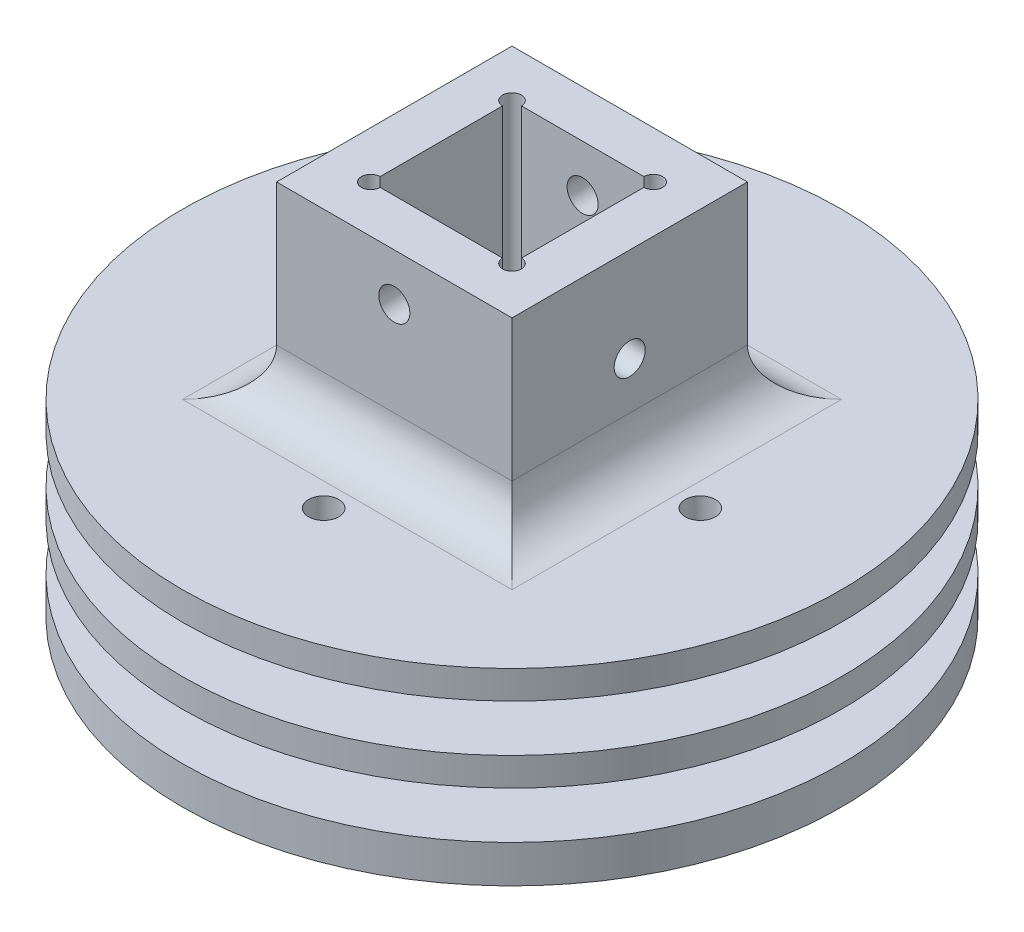
from build123d import *

# Parameters (mm, degrees)
SKETCH_1_R          = 35
EXTRUDE_1_DEPTH     = 4
SKETCH_2_R          = 25
EXTRUDE_2_DEPTH     = 5
SKETCH_3_R          = 35
EXTRUDE_3_DEPTH     = 3
SKETCH_4_R          = 25
EXTRUDE_4_DEPTH     = 5
SKETCH_5_R          = 35
EXTRUDE_5_DEPTH     = 3
CUT_EXTRUDE_1_REACH = 55.385
SKETCH_6_R          = 1.6
SKETCH_7_R          = 10
CUT_EXTRUDE_2_DEPTH = 5
SKETCH_10_W         = 25
SKETCH_10_H         = 25
SKETCH_10_W_2       = 15
SKETCH_10_H_2       = 15
EXTRUDE_6_DEPTH     = 20
SKETCH_12_R         = 1
CUT_EXTRUDE_5_DEPTH = 20
FILLET_1_R          = 5
SKETCH_13_R         = 1.65
CUT_EXTRUDE_6_DEPTH = 72.282887147
SKETCH_14_R         = 1.65
CUT_EXTRUDE_7_DEPTH = 72.282887147


with BuildPart() as part:
    # 草图1 → 凸台-拉伸1 (new body)
    with BuildSketch(Plane(origin=(0, 0, 0), x_dir=(1, 0, 0), z_dir=(0, 1, 0))):
        with Locations(Location((0, 0, 0), (0, 0, 270))):
            Circle(SKETCH_1_R)
    extrude(amount=EXTRUDE_1_DEPTH)

    # 草图2 → 凸台-拉伸2 (add)
    with BuildSketch(Plane(origin=(0, 4, 0), x_dir=(1, 0, 0), z_dir=(0, 1, 0))):
        with Locations(Location((0, 0, 0), (0, 0, 270))):
            Circle(SKETCH_2_R)
    extrude(amount=EXTRUDE_2_DEPTH)

    # 草图3 → 凸台-拉伸3 (add)
    with BuildSketch(Plane(origin=(0, 9, 0), x_dir=(1, 0, 0), z_dir=(0, 1, 0))):
        with Locations(Location((0, 0, 0), (0, 0, 270))):
            Circle(SKETCH_3_R)
    extrude(amount=EXTRUDE_3_DEPTH)

    # 草图4 → 凸台-拉伸4 (add)
    with BuildSketch(Plane(origin=(0, 12, 0), x_dir=(1, 0, 0), z_dir=(0, 1, 0))):
        with Locations(Location((0, 0, 0), (0, 0, 270))):
            Circle(SKETCH_4_R)
    extrude(amount=EXTRUDE_4_DEPTH)

    # 草图5 → 凸台-拉伸5 (add)
    with BuildSketch(Plane(origin=(0, 17, 0), x_dir=(1, 0, 0), z_dir=(0, 1, 0))):
        with Locations(Location((0, 0, 0), (0, 0, 270))):
            Circle(SKETCH_5_R)
    extrude(amount=EXTRUDE_5_DEPTH)

    # 草图6 → 切除-拉伸1 (cut, up to next)
    with BuildSketch(Plane.XZ, mode=Mode.PRIVATE) as cut_extrude_1_sk1:
        with Locations(Location((-20, 0, 0), (0, 0, 270))):
            Circle(SKETCH_6_R)
    cut_extrude_1_tool1 = extrude(cut_extrude_1_sk1.sketch, amount=-CUT_EXTRUDE_1_REACH, mode=Mode.PRIVATE) & part.part
    # 草图6 → 切除-拉伸1 (cut, up to next)
    with BuildSketch(Plane.XZ, mode=Mode.PRIVATE) as cut_extrude_1_sk2:
        with Locations(Location((0, 20, 0), (0, 0, 270))):
            Circle(SKETCH_6_R)
    cut_extrude_1_tool2 = extrude(cut_extrude_1_sk2.sketch, amount=-CUT_EXTRUDE_1_REACH, mode=Mode.PRIVATE) & part.part
    # 草图6 → 切除-拉伸1 (cut, up to next)
    with BuildSketch(Plane.XZ, mode=Mode.PRIVATE) as cut_extrude_1_sk3:
        with Locations(Location((0, -20, 0), (0, 0, 270))):
            Circle(SKETCH_6_R)
    cut_extrude_1_tool3 = extrude(cut_extrude_1_sk3.sketch, amount=-CUT_EXTRUDE_1_REACH, mode=Mode.PRIVATE) & part.part
    # 草图6 → 切除-拉伸1 (cut, up to next)
    with BuildSketch(Plane.XZ, mode=Mode.PRIVATE) as cut_extrude_1_sk4:
        with Locations(Location((20, 0, 0), (0, 0, 270))):
            Circle(SKETCH_6_R)
    cut_extrude_1_tool4 = extrude(cut_extrude_1_sk4.sketch, amount=-CUT_EXTRUDE_1_REACH, mode=Mode.PRIVATE) & part.part
    add(cut_extrude_1_tool1.solids().sort_by_distance((-20, 0, 0))[0], mode=Mode.SUBTRACT)
    add(cut_extrude_1_tool2.solids().sort_by_distance((0, 0, 20))[0], mode=Mode.SUBTRACT)
    add(cut_extrude_1_tool3.solids().sort_by_distance((0, 0, -20))[0], mode=Mode.SUBTRACT)
    add(cut_extrude_1_tool4.solids().sort_by_distance((20, 0, 0))[0], mode=Mode.SUBTRACT)

    # 草图7 → 切除-拉伸2 (cut)
    with BuildSketch(Plane.XZ):
        with Locations(Location((0, 0, 0), (0, 0, 270))):
            Circle(SKETCH_7_R)
    extrude(amount=-CUT_EXTRUDE_2_DEPTH, mode=Mode.SUBTRACT)

    # 草图10 → 凸台-拉伸6 (add)
    with BuildSketch(Plane(origin=(0, 20, 0), x_dir=(1, 0, 0), z_dir=(0, 1, 0))):
        Rectangle(SKETCH_10_W, SKETCH_10_H)
        Rectangle(SKETCH_10_W_2, SKETCH_10_H_2, mode=Mode.SUBTRACT)
    extrude(amount=EXTRUDE_6_DEPTH)

    # 草图12 → 切除-拉伸5 (cut)
    with BuildSketch(Plane(origin=(0, 40, 0), x_dir=(1, 0, 0), z_dir=(0, 1, 0))):
        with Locations((7.5, 7.5)):
            Circle(SKETCH_12_R)
        with Locations((-7.5, 7.5)):
            Circle(SKETCH_12_R)
        with Locations((-7.5, -7.5)):
            Circle(SKETCH_12_R)
        with Locations((7.5, -7.5)):
            Circle(SKETCH_12_R)
    extrude(amount=-CUT_EXTRUDE_5_DEPTH, mode=Mode.SUBTRACT)

    # 圆角1
    fillet_1_edges = [part.edges().sort_by_distance(p)[0] for p in [
        (12.5, 20, 0),
        (0, 20, -12.5),
        (-12.5, 20, 0),
        (0, 20, 12.5),
    ]]
    fillet(fillet_1_edges, radius=FILLET_1_R)

    # 草图13 → 切除-拉伸6 (cut, through all)
    with BuildSketch(Plane(origin=(12.5, 0, 0), x_dir=(0, 0, -1), z_dir=(1, 0, 0))):
        with Locations((0, 30)):
            Circle(SKETCH_13_R)
    extrude(amount=-CUT_EXTRUDE_6_DEPTH, mode=Mode.SUBTRACT)

    # 草图14 → 切除-拉伸7 (cut, through all)
    with BuildSketch(Plane(origin=(0, 0, -12.5), x_dir=(-1, 0, 0), z_dir=(0, 0, -1))):
        with Locations((0, 35)):
            Circle(SKETCH_14_R)
    extrude(amount=-CUT_EXTRUDE_7_DEPTH, mode=Mode.SUBTRACT)


solid = part.part
